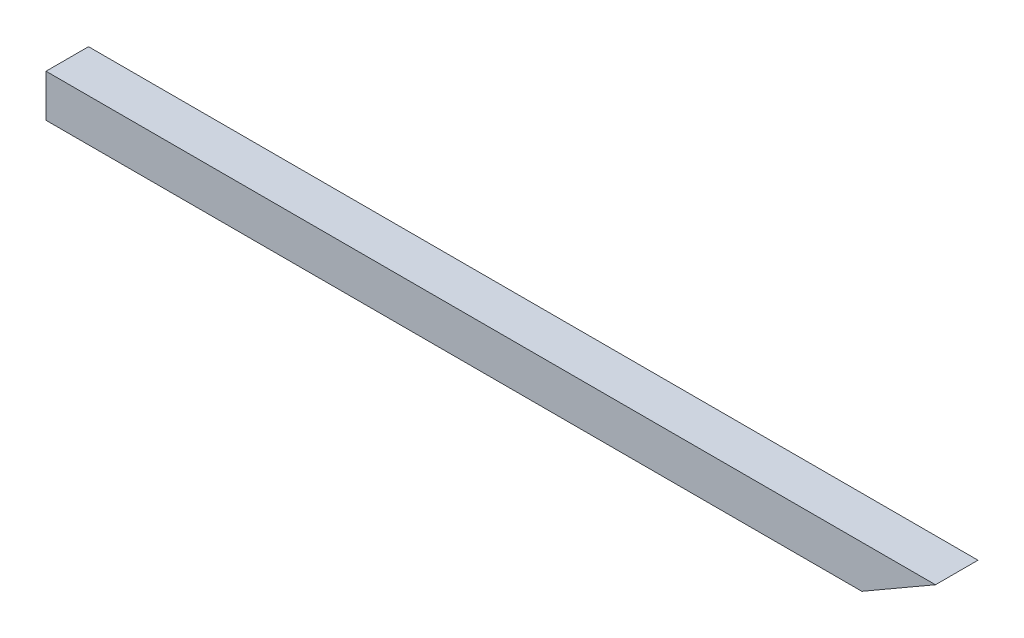
from build123d import *

# Parameters (mm, degrees)
BOSS_EXTRUDE1_DEPTH = 20


with BuildPart() as part:
    # Sketch1 → Boss-Extrude1 (new body)
    with BuildSketch(Plane.XY):
        Polygon((-37.868852459, -10.245901639), (345.911147541, -10.245901639), (380.552163692, 9.754098361), (-37.868852459, 9.754098361), align=None)
    extrude(amount=BOSS_EXTRUDE1_DEPTH)


solid = part.part
